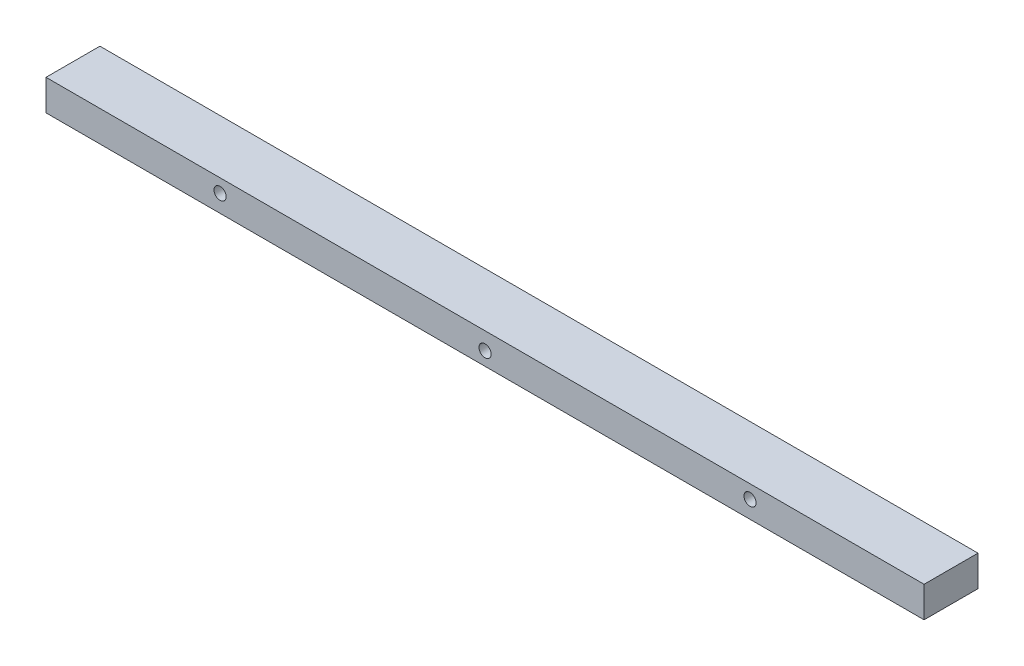
from build123d import *

# Parameters (mm, degrees)
SKETCH1_W           = 361.95
SKETCH1_H           = 12.7
SKETCH1_R           = 2.5
BOSS_EXTRUDE1_DEPTH = 22.225


with BuildPart() as part:
    # Sketch1 → Boss-Extrude1 (new body)
    with BuildSketch(Plane.XY):
        with Locations((180.975, 6.35)):
            Rectangle(SKETCH1_W, SKETCH1_H)
        with Locations((180.975, 5.55625)):
            Circle(SKETCH1_R, mode=Mode.SUBTRACT)
        with Locations((71.755, 7.14375)):
            Circle(SKETCH1_R, mode=Mode.SUBTRACT)
        with Locations((290.195, 7.14375)):
            Circle(SKETCH1_R, mode=Mode.SUBTRACT)
    extrude(amount=BOSS_EXTRUDE1_DEPTH)


solid = part.part
